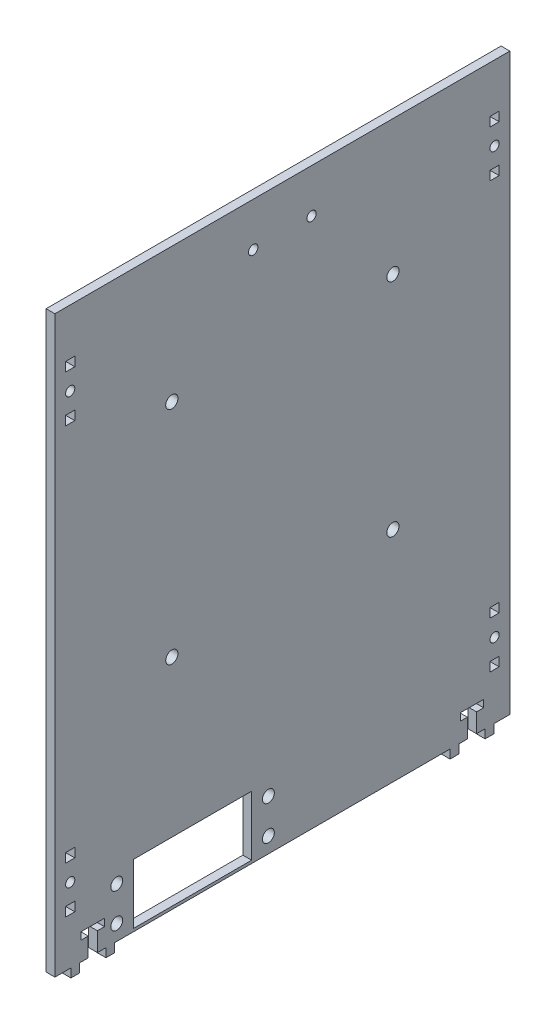
from build123d import *

# Parameters (mm, degrees)
BOSS_EXTRUDE2_DEPTH      = 1.5
BOSS_EXTRUDE2_DEPTH_BACK = 1.5
SKETCH1_R                = 1.575
SKETCH1_R_2              = 2.05
SKETCH1_R_3              = 2.1
SKETCH1_R_4              = 1.6
SKETCH1_W                = 40.5
SKETCH1_H                = 20.499999995
SKETCH1_W_2              = 3.15
SKETCH1_H_2              = 3.15


with BuildPart() as part:
    # Sketch1 → Boss-Extrude2 (new, two sides: drawn at the far end of the back side and taken through both)
    with BuildSketch(Plane(origin=(0, 0, 0), x_dir=(0, 0, -1), z_dir=(1, 0, 0)).offset(-BOSS_EXTRUDE2_DEPTH_BACK)):
        Polygon((11.425, 0), (8.5, 0), (8.5, -3), (5.5, -3), (5.5, 0), (0, 0), (0, 197), (156, 197), (156, 0), (150.5, 0), (150.5, -3), (147.5, -3), (147.5, 0), (144.575, 0), (144.575, 6.5), (147, 6.5), (147, 9), (139, 9), (139, 6.5), (141.425, 6.5), (141.425, 0), (138.5, 0), (138.5, -3), (135.5, -3), (135.5, 0), (20.5, 0), (20.5, -3), (17.5, -3), (17.5, 0), (14.575, 0), (14.575, 6.5), (17, 6.5), (17, 9), (9, 9), (9, 6.5), (11.425, 6.5), align=None)
        with Locations((5.25, 25.575)):
            Circle(SKETCH1_R, mode=Mode.SUBTRACT)
        with Locations((5.25, 171.425)):
            Circle(SKETCH1_R, mode=Mode.SUBTRACT)
        with Locations((150.75, 171.425)):
            Circle(SKETCH1_R, mode=Mode.SUBTRACT)
        with Locations((150.75, 25.575)):
            Circle(SKETCH1_R, mode=Mode.SUBTRACT)
        with Locations((73.2, 5.35)):
            Circle(SKETCH1_R_2, mode=Mode.SUBTRACT)
        with Locations((73.2, 17.149999995)):
            Circle(SKETCH1_R_2, mode=Mode.SUBTRACT)
        with Locations((21.2, 5.35)):
            Circle(SKETCH1_R_2, mode=Mode.SUBTRACT)
        with Locations((21.2, 17.149999995)):
            Circle(SKETCH1_R_2, mode=Mode.SUBTRACT)
        with Locations((40.1, 75)):
            Circle(SKETCH1_R_3, mode=Mode.SUBTRACT)
        with Locations((40.1, 150.8)):
            Circle(SKETCH1_R_3, mode=Mode.SUBTRACT)
        with Locations((115.9, 75)):
            Circle(SKETCH1_R_3, mode=Mode.SUBTRACT)
        with Locations((115.9, 150.8)):
            Circle(SKETCH1_R_3, mode=Mode.SUBTRACT)
        with Locations((88, 182)):
            Circle(SKETCH1_R_4, mode=Mode.SUBTRACT)
        with Locations((68, 182)):
            Circle(SKETCH1_R_4, mode=Mode.SUBTRACT)
        with Locations((47.2, 11.249999997)):
            Rectangle(SKETCH1_W, SKETCH1_H, mode=Mode.SUBTRACT)
        with Locations((5.25, 17.575)):
            Rectangle(SKETCH1_W_2, SKETCH1_H_2, mode=Mode.SUBTRACT)
        with Locations((5.25, 33.575)):
            Rectangle(SKETCH1_W_2, SKETCH1_H_2, mode=Mode.SUBTRACT)
        with Locations((5.25, 163.425)):
            Rectangle(SKETCH1_W_2, SKETCH1_H_2, mode=Mode.SUBTRACT)
        with Locations((5.25, 179.425)):
            Rectangle(SKETCH1_W_2, SKETCH1_H_2, mode=Mode.SUBTRACT)
        with Locations((150.75, 179.425)):
            Rectangle(SKETCH1_W_2, SKETCH1_H_2, mode=Mode.SUBTRACT)
        with Locations((150.75, 163.425)):
            Rectangle(SKETCH1_W_2, SKETCH1_H_2, mode=Mode.SUBTRACT)
        with Locations((150.75, 33.575)):
            Rectangle(SKETCH1_W_2, SKETCH1_H_2, mode=Mode.SUBTRACT)
        with Locations((150.75, 17.575)):
            Rectangle(SKETCH1_W_2, SKETCH1_H_2, mode=Mode.SUBTRACT)
    extrude(amount=BOSS_EXTRUDE2_DEPTH + BOSS_EXTRUDE2_DEPTH_BACK)


solid = part.part
